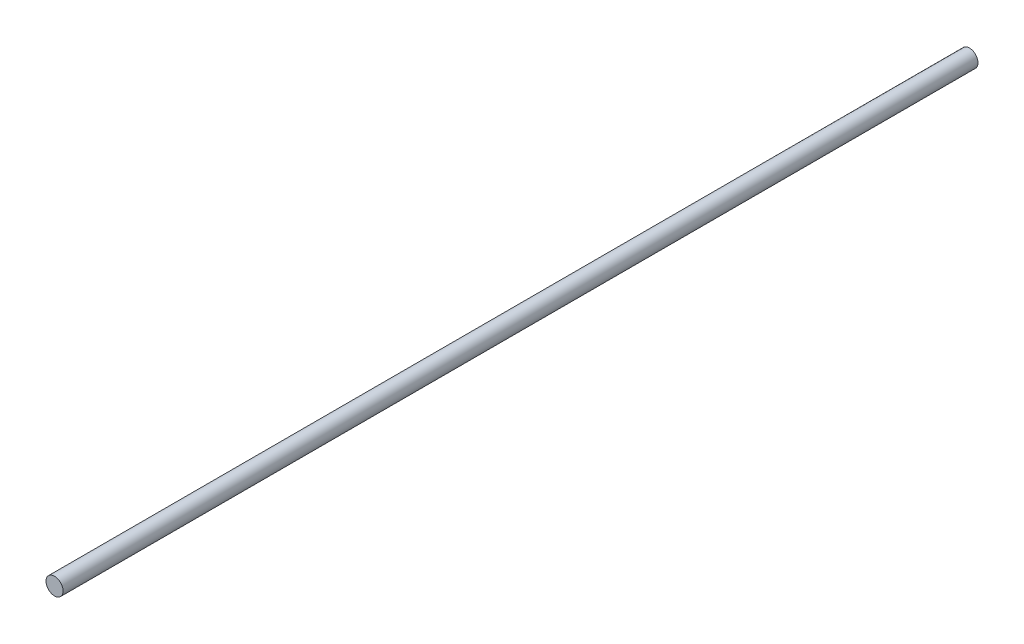
from build123d import *

# Parameters (mm, degrees)
SKETCH_6_R      = 1.6
EXTRUDE_3_DEPTH = 171


with BuildPart() as part:
    # 草图6 → 凸台-拉伸3 (new body)
    with BuildSketch(Plane.XY):
        Circle(SKETCH_6_R)
    extrude(amount=EXTRUDE_3_DEPTH)


solid = part.part
